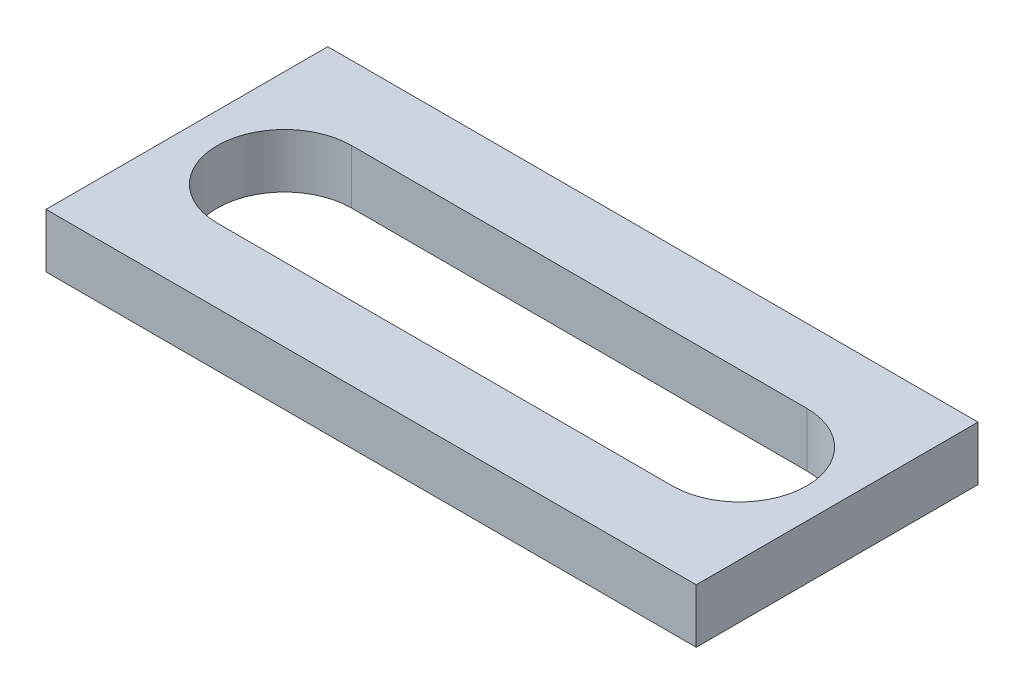
from build123d import *

# Parameters (mm, degrees)
SKETCH1_W           = 30
SKETCH1_H           = 13
BOSS_EXTRUDE1_DEPTH = 2.5


with BuildPart() as part:
    # Sketch1 → Boss-Extrude1 (new body)
    with BuildSketch(Plane(origin=(0, 0, 0), x_dir=(1, 0, 0), z_dir=(0, 1, 0))):
        Rectangle(SKETCH1_W, SKETCH1_H)
        with BuildLine():
            Line((-10.5, 3.1), (10.5, 3.1))
            ThreePointArc((10.5, 3.1), (13.6, 0), (10.5, -3.1))
            Line((10.5, -3.1), (-10.5, -3.1))
            ThreePointArc((-10.5, -3.1), (-13.6, 0), (-10.5, 3.1))
        make_face(mode=Mode.SUBTRACT)
    extrude(amount=BOSS_EXTRUDE1_DEPTH)


solid = part.part
